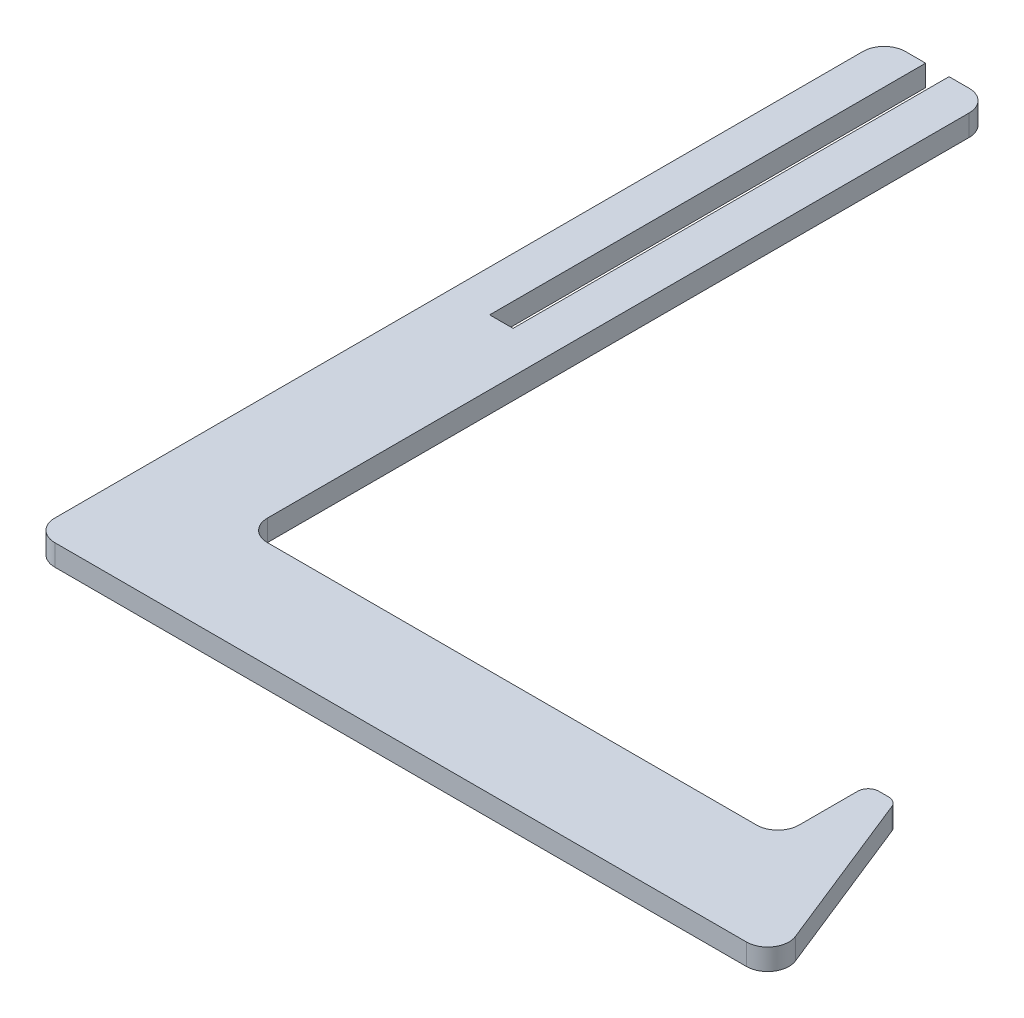
from build123d import *

# Parameters (mm, degrees)
BOSS_EXTRUDE1_DEPTH = 2
FILLET1_R           = 2
CUT_EXTRUDE1_DEPTH  = 106.694564726
FILLET2_R           = 1
SKETCH3_W           = 2.2
SKETCH3_H           = 41
CUT_EXTRUDE2_DEPTH  = 10


with BuildPart() as part:
    # Sketch1 → Boss-Extrude1 (new body)
    with BuildSketch(Plane(origin=(0, 0, 0), x_dir=(1, 0, 0), z_dir=(0, 1, 0))):
        Polygon((0, 0), (0, 80), (10, 80), (10, 10), (60, 10), (60, 25), (70, 0), align=None)
    extrude(amount=BOSS_EXTRUDE1_DEPTH)

    # Fillet1
    fillet1_edges = [part.edges().sort_by_distance(p)[0] for p in [
        (0, 1, 0),
        (0, 1, -80),
        (10, 1, -80),
        (10, 1, -10),
        (60, 1, -10),
        (70, 1, 0),
    ]]
    fillet(fillet1_edges, radius=FILLET1_R)

    # Sketch2 → Cut-Extrude1 (cut, through all)
    with BuildSketch(Plane(origin=(0, 2, 0), x_dir=(1, 0, 0), z_dir=(0, 1, 0))):
        Polygon((60, 18.5), (62.6, 18.5), (60, 25), align=None)
    extrude(amount=-CUT_EXTRUDE1_DEPTH, mode=Mode.SUBTRACT)

    # Fillet2
    fillet2_edges = [part.edges().sort_by_distance(p)[0] for p in [
        (60, 1, -18.5),
        (62.6, 1, -18.5),
    ]]
    fillet(fillet2_edges, radius=FILLET2_R)

    # Sketch3 → Cut-Extrude2 (cut)
    with BuildSketch(Plane(origin=(0, 2, 0), x_dir=(1, 0, 0), z_dir=(0, 1, 0))):
        with Locations((5, 59.5)):
            Rectangle(SKETCH3_W, SKETCH3_H)
    extrude(amount=-CUT_EXTRUDE2_DEPTH, mode=Mode.SUBTRACT)


solid = part.part
